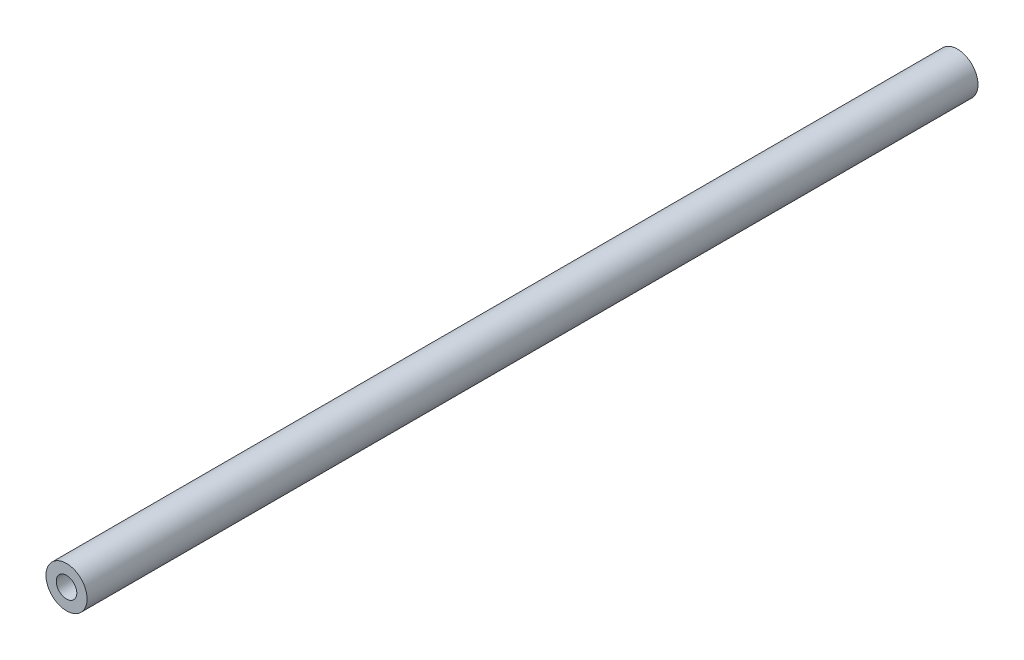
from build123d import *

# Parameters (mm, degrees)
SKETCH_1_R      = 3
SKETCH_1_R_2    = 1.5
EXTRUDE_1_DEPTH = 130


with BuildPart() as part:
    # 草图1 → 凸台-拉伸1 (new body)
    with BuildSketch(Plane.XY):
        Circle(SKETCH_1_R)
        Circle(SKETCH_1_R_2, mode=Mode.SUBTRACT)
    extrude(amount=EXTRUDE_1_DEPTH)


solid = part.part
